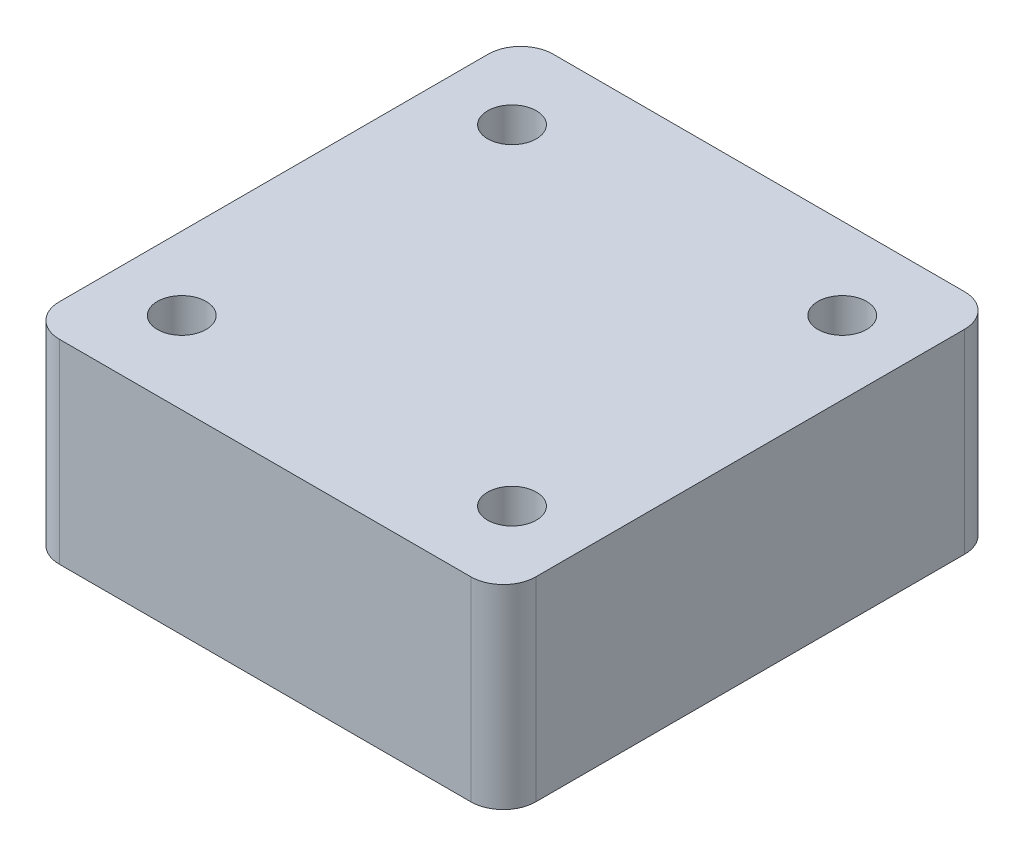
from build123d import *

# Parameters (mm, degrees)
SKETCH1_W            = 44
SKETCH1_H            = 45.6
BOSS_EXTRUDE1_DEPTH  = 18
FILLET1_R            = 3
M4_CLEARANCE_HOLE1_D = 4.5


with BuildPart() as part:
    # Sketch1 → Boss-Extrude1 (new body)
    with BuildSketch(Plane(origin=(0, 0, 0), x_dir=(1, 0, 0), z_dir=(0, 1, 0))):
        Rectangle(SKETCH1_W, SKETCH1_H)
    extrude(amount=BOSS_EXTRUDE1_DEPTH)

    # Fillet1
    fillet1_edges = [part.edges().sort_by_distance(p)[0] for p in [
        (22, 9, 22.8),
        (-22, 9, 22.8),
        (-22, 9, -22.8),
        (22, 9, -22.8),
    ]]
    fillet(fillet1_edges, radius=FILLET1_R)

    # M4 Clearance Hole1 (through all)
    with Locations(Plane(origin=(0, 18, 0), x_dir=(1, 0, 0), z_dir=(0, 1, 0))):
        with Locations((15.25, -15.25), (-15.25, 15.25), (-15.25, -15.25), (15.25, 15.25)):
            Hole(M4_CLEARANCE_HOLE1_D / 2)


solid = part.part
